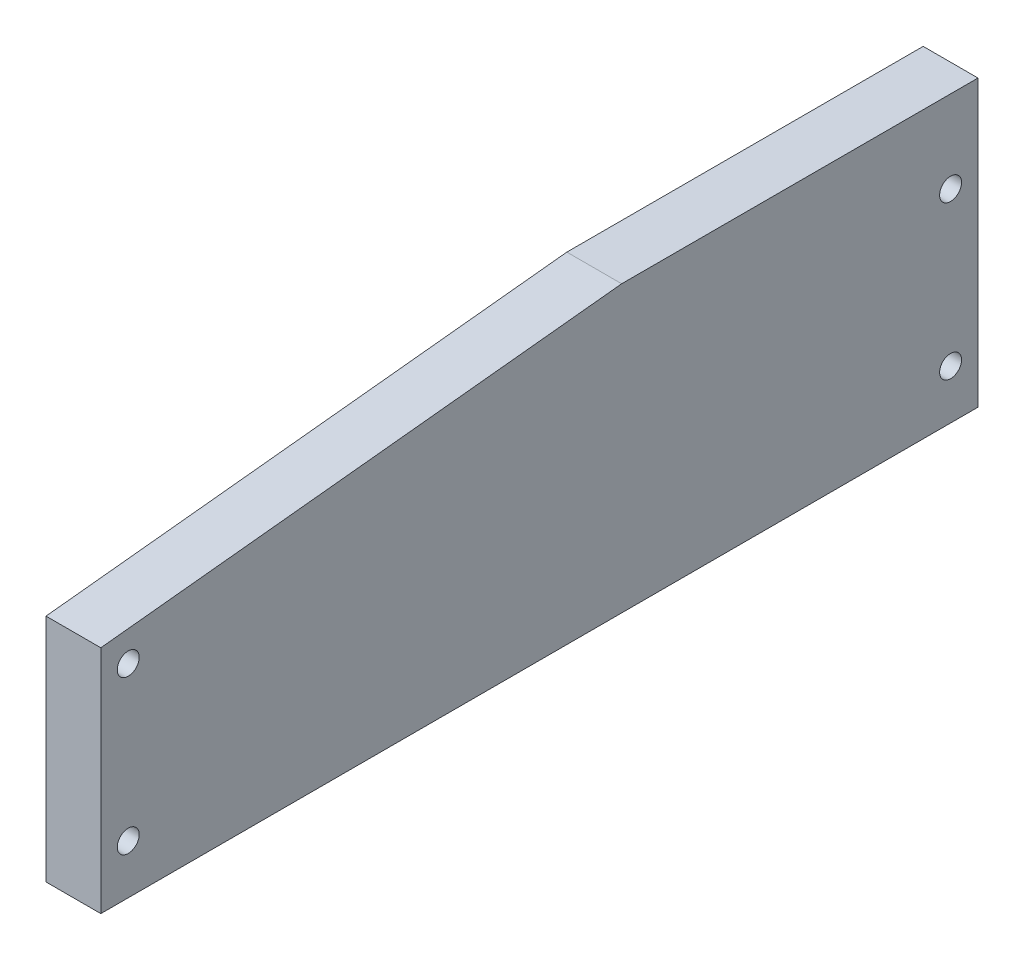
from build123d import *

# Parameters (mm, degrees)
BOSS_EXTRUDE1_DEPTH = 10
SKETCH4_R           = 2
CUT_EXTRUDE1_DEPTH  = 5


with BuildPart() as part:
    # Sketch3 → Boss-Extrude1 (new body)
    with BuildSketch(Plane(origin=(0, 0, 0), x_dir=(0, 0, -1), z_dir=(1, 0, 0))):
        Polygon((18.594382672, 46.957725761), (18.594382672, -5.042274239), (-141.405617328, -5.042274239), (-141.405617328, 36.957725761), (-46.405617328, 46.957725761), align=None)
    extrude(amount=BOSS_EXTRUDE1_DEPTH)

    # Sketch4 → Cut-Extrude1 (cut)
    with BuildSketch(Plane(origin=(10, 0, 0), x_dir=(0, 0, -1), z_dir=(1, 0, 0))):
        with Locations((-136.405617328, 31.957725761)):
            Circle(SKETCH4_R)
        with Locations((-136.405617328, 3.957725761)):
            Circle(SKETCH4_R)
        with Locations((13.594382672, 3.957725761)):
            Circle(SKETCH4_R)
        with Locations((13.594382672, 31.957725761)):
            Circle(SKETCH4_R)
    extrude(amount=-CUT_EXTRUDE1_DEPTH, mode=Mode.SUBTRACT)


solid = part.part
